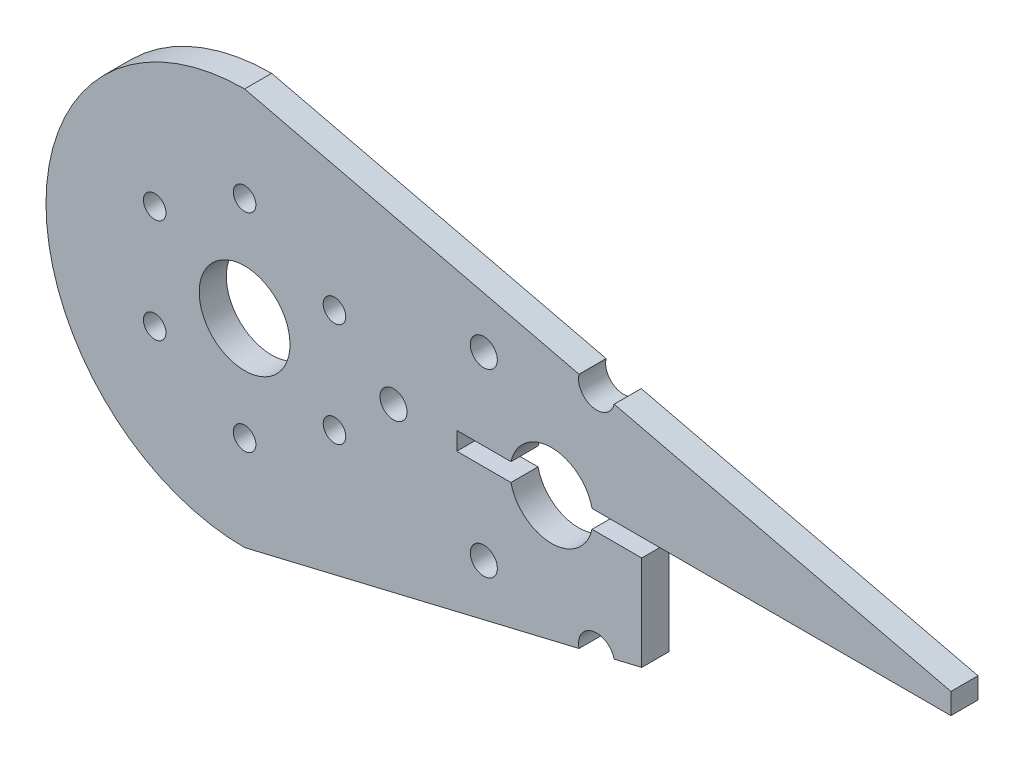
from build123d import *

# Parameters (mm, degrees)
SKETCH_1_R          = 5.03
SKETCH_1_R_2        = 1.25
SKETCH_1_R_3        = 1.5
EXTRUDE_1_DEPTH     = 3
SKETCH_2_R          = 2
CUT_EXTRUDE_1_DEPTH = 4


with BuildPart() as part:
    # 草图1 → 凸台-拉伸1 (new body)
    with BuildSketch(Plane.XY):
        with BuildLine():
            Line((-15.488984032, 1), (-9.488984032, 1))
            ThreePointArc((-9.488984032, 1), (-4.998995168, 4.6), (-0.509006304, 1))
            Line((-0.509006304, 1), (5.001004832, 1))
            Line((5.001004832, 1), (39.254812875, 1))
            Line((39.254812875, 1), (39.254812875, 3.326018382))
            Line((39.254812875, 3.326018382), (5.001004832, 11.501004832))
            Line((5.001004832, 11.501004832), (-38.998995168, 22.002009663))
            ThreePointArc((-38.998995168, 22.002009663), (-61.001004832, 0), (-38.998995168, -22.002009663))
            Line((-38.998995168, -22.002009663), (5.001004832, -11.501004832))
            Line((5.001004832, -11.501004832), (5.001004832, -1))
            Line((5.001004832, -1), (-0.509006304, -1))
            ThreePointArc((-0.509006304, -1), (-4.998995168, -4.6), (-9.488984032, -1))
            Line((-9.488984032, -1), (-15.488984032, -1))
            Line((-15.488984032, -1), (-15.488984032, 1))
        make_face()
        with Locations((-38.998995168, 0)):
            Circle(SKETCH_1_R, mode=Mode.SUBTRACT)
        with Locations((-38.998995168, -11.5)):
            Circle(SKETCH_1_R_2, mode=Mode.SUBTRACT)
        with Locations((-12.498995168, -10)):
            Circle(SKETCH_1_R_3, mode=Mode.SUBTRACT)
        with Locations((-22.498995168, 0)):
            Circle(SKETCH_1_R_3, mode=Mode.SUBTRACT)
        with Locations((-48.958287312, -5.75)):
            Circle(SKETCH_1_R_2, mode=Mode.SUBTRACT)
        with Locations(Location((-12.498995168, 10, 0), (0, 0, 180))):
            Circle(SKETCH_1_R_3, mode=Mode.SUBTRACT)
        with Locations((-48.958287312, 5.75)):
            Circle(SKETCH_1_R_2, mode=Mode.SUBTRACT)
        with Locations((-38.998995168, 11.5)):
            Circle(SKETCH_1_R_2, mode=Mode.SUBTRACT)
        with Locations((-29.039703025, 5.75)):
            Circle(SKETCH_1_R_2, mode=Mode.SUBTRACT)
        with Locations((-29.039703025, -5.75)):
            Circle(SKETCH_1_R_2, mode=Mode.SUBTRACT)
    extrude(amount=EXTRUDE_1_DEPTH)

    # 草图2 → 切除-拉伸1 (cut)
    with BuildSketch(Plane(origin=(0, 0, 0), x_dir=(-1, 0, 0), z_dir=(0, 0, -1))):
        with Locations((0, 12.694540648)):
            Circle(SKETCH_2_R)
        with Locations((0, -12.694540648)):
            Circle(SKETCH_2_R)
    extrude(amount=-CUT_EXTRUDE_1_DEPTH, mode=Mode.SUBTRACT)


solid = part.part
